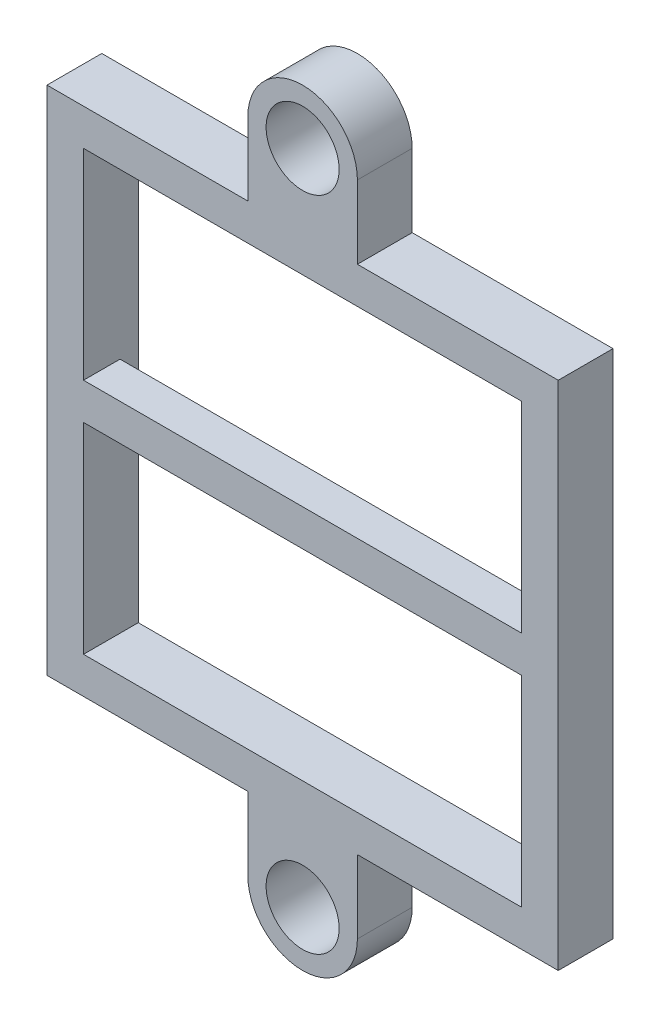
from build123d import *

# Parameters (mm, degrees)
SKETCH_6_W          = 14
SKETCH_6_H          = 14
SKETCH_6_W_2        = 12
SKETCH_6_H_2        = 12
EXTRUDE_3_DEPTH     = 1.5
SKETCH_7_W          = 3
SKETCH_7_H          = 1.5
EXTRUDE_4_DEPTH     = 3.5
CUT_EXTRUDE_3_DEPTH = 4
SKETCH_11_R         = 1
CUT_EXTRUDE_5_DEPTH = 4
SKETCH_12_W         = 12
SKETCH_12_H         = 1
EXTRUDE_5_DEPTH     = 1


with BuildPart() as part:
    # 草图6 → 凸台-拉伸3 (new body)
    with BuildSketch(Plane.XY):
        Rectangle(SKETCH_6_W, SKETCH_6_H)
        Rectangle(SKETCH_6_W_2, SKETCH_6_H_2, mode=Mode.SUBTRACT)
    extrude(amount=EXTRUDE_3_DEPTH)

    # 草图7 → 凸台-拉伸4 (add)
    with BuildSketch(Plane.XZ.offset(7)):
        with Locations((0, 0.75)):
            Rectangle(SKETCH_7_W, SKETCH_7_H)
    extrude_4 = extrude(amount=EXTRUDE_4_DEPTH)

    # 草图8 → 切除-拉伸3 (cut)
    with BuildSketch(Plane.XY.offset(1.5)):
        with BuildLine():
            ThreePointArc((0, -10.5), (-1.060660172, -10.060660172), (-1.5, -9))
            Line((-1.5, -9), (-1.5, -10.5))
            Line((-1.5, -10.5), (0, -10.5))
        make_face()
        with BuildLine():
            Line((1.5, -10.5), (1.5, -9))
            ThreePointArc((1.5, -9), (1.060660172, -10.060660172), (0, -10.5))
            Line((0, -10.5), (1.5, -10.5))
        make_face()
    cut_extrude_3 = extrude(amount=-CUT_EXTRUDE_3_DEPTH, mode=Mode.SUBTRACT)

    # 草图11 → 切除-拉伸5 (cut)
    with BuildSketch(Plane.XY.offset(1.5)):
        with Locations((0, -9)):
            Circle(SKETCH_11_R)
    cut_extrude_5 = extrude(amount=-CUT_EXTRUDE_5_DEPTH, mode=Mode.SUBTRACT)

    # 镜向1: 凸台-拉伸4, 切除-拉伸3, 切除-拉伸5 across plane
    add(extrude_4.mirror(Plane.ZX))
    add(cut_extrude_3.mirror(Plane.ZX), mode=Mode.SUBTRACT)
    add(cut_extrude_5.mirror(Plane.ZX), mode=Mode.SUBTRACT)

    # 草图12 → 凸台-拉伸5 (add)
    with BuildSketch(Plane.XY.offset(1.5)):
        Rectangle(SKETCH_12_W, SKETCH_12_H)
    extrude(amount=-EXTRUDE_5_DEPTH)


solid = part.part
